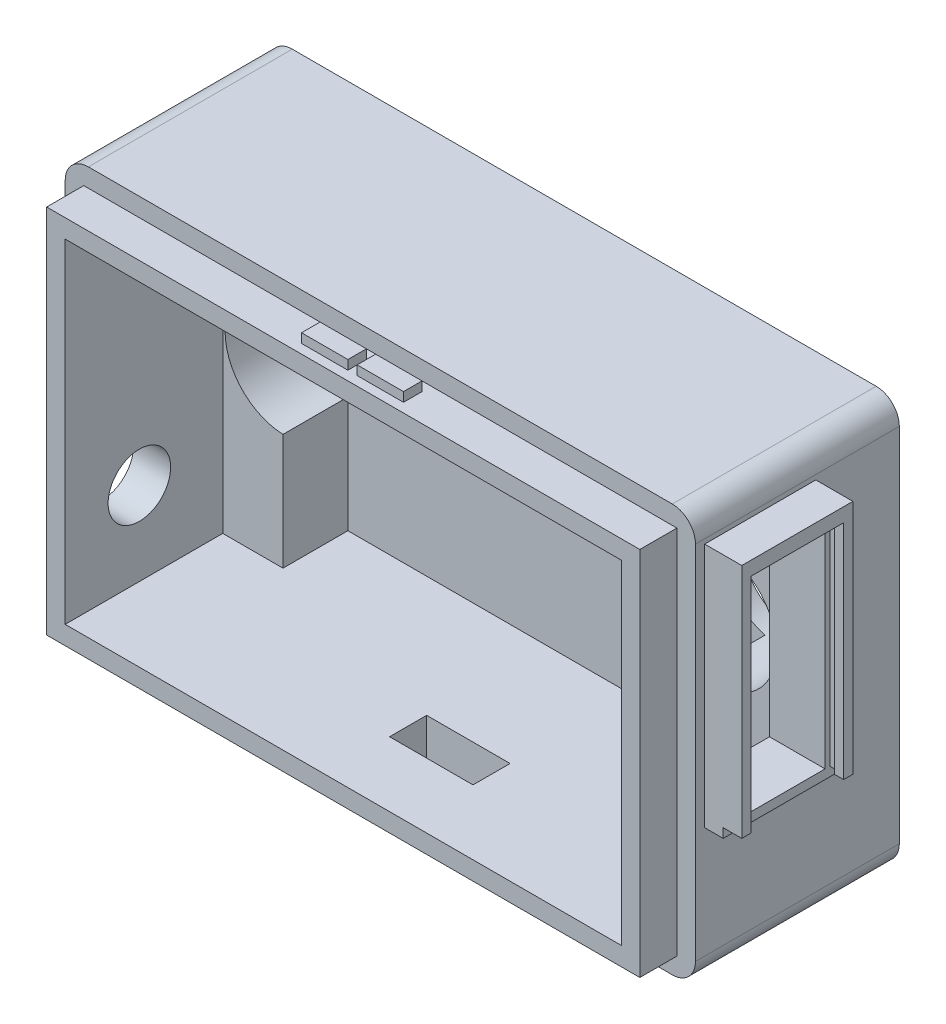
from build123d import *

# Parameters (mm, degrees)
SKETCH1_W                   = 68
SKETCH1_H                   = 44
MIAN_BOSS_EXTRUDE_DEPTH     = 26
SKETCH2_W                   = 60
SKETCH2_H                   = 36
MAIN_CUT_DEPTH              = 17
SKETCH4_W                   = 45
SKETCH4_H                   = 35
BATTERY_CUT_DEPTH           = 7
SKETCH5_R                   = 6.5
ELCTRODE_CUT_DEPTH          = 12
SKETCH6_W                   = 9.989337028
SKETCH6_H                   = 24.5
USB_C_CUT_DEPTH             = 7
SKETCH7_R                   = 3.375
BUTTON_CUT_DEPTH            = 7
SKETCH8_W                   = 9
SKETCH8_H                   = 4
SWITCH_CUT_DEPTH            = 7
OUTSIDE_FILLET_R            = 2.5
SKETCH10_OUTSIDE_W          = 87.012
SKETCH10_OUTSIDE_H          = 63.012
SKETCH10_OUTSIDE_W_2        = 64
SKETCH10_OUTSIDE_H_2        = 40
OUTER_LID_EXTRUDE_DEPTH     = 4
LID_SNAP_EXTRUDE_DEPTH      = 1
LID_SNAP_EXTRUDE_DEPTH_BACK = 41
SKETCH11_W                  = 5
SKETCH11_H                  = 2
SKETCH13_W                  = 11
SKETCH13_H                  = 36
INNER_LID_EXTRUDE_DEPTH     = 3
SKETCH14_W                  = 11.989337028
SKETCH14_H                  = 26.5
SKETCH14_W_2                = 9.989337028
SKETCH14_H_2                = 24.5
USB_COVER_EXTRUDE_DEPTH     = 4
SKETCH15_W                  = 11.989337028
SKETCH15_H                  = 1
USB_CUT_EXTRUDE_DEPTH       = 2
USB_LIP_CUT_DEPTH           = 10.5
USB_LIP_CUT_DEPTH_BACK      = 0.5
SKETCH18_W                  = 1
SKETCH18_H                  = 24.5
SKETCH20_W                  = 1
SKETCH20_H                  = 9.989337028
USB_LIP_BOSS_DEPTH          = 0.5


with BuildPart() as part:
    # Sketch1 → Mian Boss Extrude (new body)
    with BuildSketch(Plane.XY):
        with Locations((34, 22)):
            Rectangle(SKETCH1_W, SKETCH1_H)
    extrude(amount=MIAN_BOSS_EXTRUDE_DEPTH)

    # Sketch2 → Main cut (cut)
    with BuildSketch(Plane.XY.offset(26)):
        with Locations((34, 22)):
            Rectangle(SKETCH2_W, SKETCH2_H)
    extrude(amount=-MAIN_CUT_DEPTH, mode=Mode.SUBTRACT)

    # Sketch4 → Battery Cut (cut)
    with BuildSketch(Plane.XY.offset(9)):
        with Locations((33, 21.5)):
            Rectangle(SKETCH4_W, SKETCH4_H)
    extrude(amount=-BATTERY_CUT_DEPTH, mode=Mode.SUBTRACT)

    # Sketch5 → Elctrode Cut (cut)
    with BuildSketch(Plane(origin=(0, 0, 0), x_dir=(-1, 0, 0), z_dir=(0, 0, -1))):
        with Locations((-57.25, 23)):
            Circle(SKETCH5_R)
        with Locations((-10.75, 23)):
            Circle(SKETCH5_R)
    extrude(amount=-ELCTRODE_CUT_DEPTH, mode=Mode.SUBTRACT)

    # Sketch6 → USB-c Cut (cut)
    with BuildSketch(Plane(origin=(68, 0, 0), x_dir=(0, 0, -1), z_dir=(1, 0, 0))):
        with Locations((-15.005331486, 27.75)):
            Rectangle(SKETCH6_W, SKETCH6_H)
    extrude(amount=-USB_C_CUT_DEPTH, mode=Mode.SUBTRACT)

    # Sketch7 → Button Cut (cut)
    with BuildSketch(Plane.ZY):
        with Locations((18, 13)):
            Circle(SKETCH7_R)
    extrude(amount=-BUTTON_CUT_DEPTH, mode=Mode.SUBTRACT)

    # Sketch8 → Switch Cut (cut)
    with BuildSketch(Plane.XZ):
        with Locations((36.5, 17)):
            Rectangle(SKETCH8_W, SKETCH8_H)
    extrude(amount=-SWITCH_CUT_DEPTH, mode=Mode.SUBTRACT)

    # Outside Fillet
    outside_fillet_edges = [part.edges().sort_by_distance(p)[0] for p in [
        (68, 44, 13),
        (68, 0, 13),
        (0, 0, 13),
        (0, 44, 13),
    ]]
    fillet(outside_fillet_edges, radius=OUTSIDE_FILLET_R)

    # Sketch10 outside → Outer lid Extrude (cut)
    with BuildSketch(Plane.XY.offset(26)):
        with Locations((34, 22)):
            Rectangle(SKETCH10_OUTSIDE_W, SKETCH10_OUTSIDE_H)
        with Locations((34, 22)):
            Rectangle(SKETCH10_OUTSIDE_W_2, SKETCH10_OUTSIDE_H_2, mode=Mode.SUBTRACT)
    extrude(amount=-OUTER_LID_EXTRUDE_DEPTH, mode=Mode.SUBTRACT)

    # Sketch11 → Lid Snap-Extrude (add, two sides: drawn at the far end of the back side and taken through both)
    with BuildSketch(Plane.XZ.offset(-2).offset(-LID_SNAP_EXTRUDE_DEPTH_BACK)):
        with Locations((31, 24)):
            Rectangle(SKETCH11_W, SKETCH11_H)
        with Locations((37, 24)):
            Rectangle(SKETCH11_W, SKETCH11_H)
    extrude(amount=LID_SNAP_EXTRUDE_DEPTH + LID_SNAP_EXTRUDE_DEPTH_BACK)

    # Sketch13 → Inner Lid-Extrude (cut)
    with BuildSketch(Plane.XY.offset(25)):
        with Locations((34, 22)):
            Rectangle(SKETCH13_W, SKETCH13_H)
    extrude(amount=-INNER_LID_EXTRUDE_DEPTH, mode=Mode.SUBTRACT)

    # Sketch14 → USB Cover-Extrude (add)
    with BuildSketch(Plane(origin=(68, 0, 0), x_dir=(0, 0, -1), z_dir=(1, 0, 0))):
        with Locations((-15.005331486, 27.75)):
            Rectangle(SKETCH14_W, SKETCH14_H)
        with Locations((-15.005331486, 27.75)):
            Rectangle(SKETCH14_W_2, SKETCH14_H_2, mode=Mode.SUBTRACT)
    extrude(amount=USB_COVER_EXTRUDE_DEPTH)

    # Sketch15 → USB Cut-Extrude (cut)
    with BuildSketch(Plane(origin=(72, 0, 0), x_dir=(0, 0, -1), z_dir=(1, 0, 0))):
        with Locations((-15.005331486, 15)):
            Rectangle(SKETCH15_W, SKETCH15_H)
    extrude(amount=-USB_CUT_EXTRUDE_DEPTH, mode=Mode.SUBTRACT)

    # Sketch18 → USB Lip Cut (cut, two sides: drawn at the far end of the back side and taken through both)
    with BuildSketch(Plane(origin=(0, 0, 20), x_dir=(-1, 0, 0), z_dir=(0, 0, -1)).offset(-USB_LIP_CUT_DEPTH_BACK)):
        with Locations((-70.5, 27.75)):
            Rectangle(SKETCH18_W, SKETCH18_H)
    extrude(amount=USB_LIP_CUT_DEPTH + USB_LIP_CUT_DEPTH_BACK, mode=Mode.SUBTRACT)

    # Sketch20 → USB Lip Boss (add)
    with BuildSketch(Plane.XZ.offset(-40)):
        with Locations((71.5, 15.005331486)):
            Rectangle(SKETCH20_W, SKETCH20_H)
    extrude(amount=USB_LIP_BOSS_DEPTH)


solid = part.part
